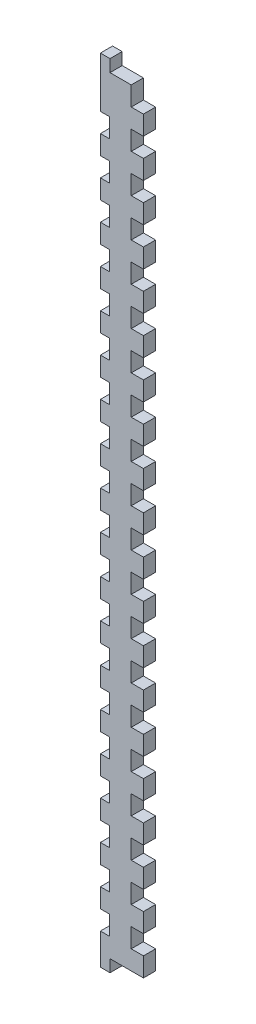
from build123d import *

# Parameters (mm, degrees)
SKETCH1_W           = 22.4282
SKETCH1_H           = 400
BOSS_EXTRUDE1_DEPTH = 6.35
SKETCH2_W           = 4.6228
SKETCH2_H           = 10
CUT_EXTRUDE2_DEPTH  = 6.35
SKETCH13_W          = 6.35
SKETCH13_H          = 10
CUT_EXTRUDE4_DEPTH  = 6.35
LPATTERN1_COUNT     = 19
LPATTERN1_PITCH     = 20
LPATTERN2_COUNT     = 20
LPATTERN2_PITCH     = 20
SKETCH14_W          = 5.0038
SKETCH14_H          = 6.35
BOSS_EXTRUDE4_DEPTH = 6.35


with BuildPart() as part:
    # Sketch1 → Boss-Extrude1 (new body)
    with BuildSketch(Plane.XY):
        Rectangle(SKETCH1_W, SKETCH1_H)
    extrude(amount=BOSS_EXTRUDE1_DEPTH)

    # Sketch2 → Cut-Extrude2 (cut)
    with BuildSketch(Plane.XY.offset(6.35)):
        with Locations((-8.9027, -185)):
            Rectangle(SKETCH2_W, SKETCH2_H)
    cut_extrude2 = extrude(amount=-CUT_EXTRUDE2_DEPTH, mode=Mode.SUBTRACT)

    # Sketch13 → Cut-Extrude4 (cut)
    with BuildSketch(Plane.XY.offset(6.35)):
        with Locations((8.0391, -185)):
            Rectangle(SKETCH13_W, SKETCH13_H)
    cut_extrude4 = extrude(amount=-CUT_EXTRUDE4_DEPTH, mode=Mode.SUBTRACT)

    # LPattern1: Cut-Extrude2 ×19
    with Locations(*[(0, i * LPATTERN1_PITCH, 0) for i in range(1, LPATTERN1_COUNT)]):
        add(cut_extrude2, mode=Mode.SUBTRACT)

    # LPattern2: Cut-Extrude4 ×20
    with Locations(*[(0, i * LPATTERN2_PITCH, 0) for i in range(1, LPATTERN2_COUNT)]):
        add(cut_extrude4, mode=Mode.SUBTRACT)

    # Sketch14 → Boss-Extrude4 (add)
    with BuildSketch(Plane.XY):
        with Locations((-8.7122, 203.175)):
            Rectangle(SKETCH14_W, SKETCH14_H)
        with Locations((-8.7122, -203.175)):
            Rectangle(SKETCH14_W, SKETCH14_H)
    extrude(amount=BOSS_EXTRUDE4_DEPTH)


solid = part.part
